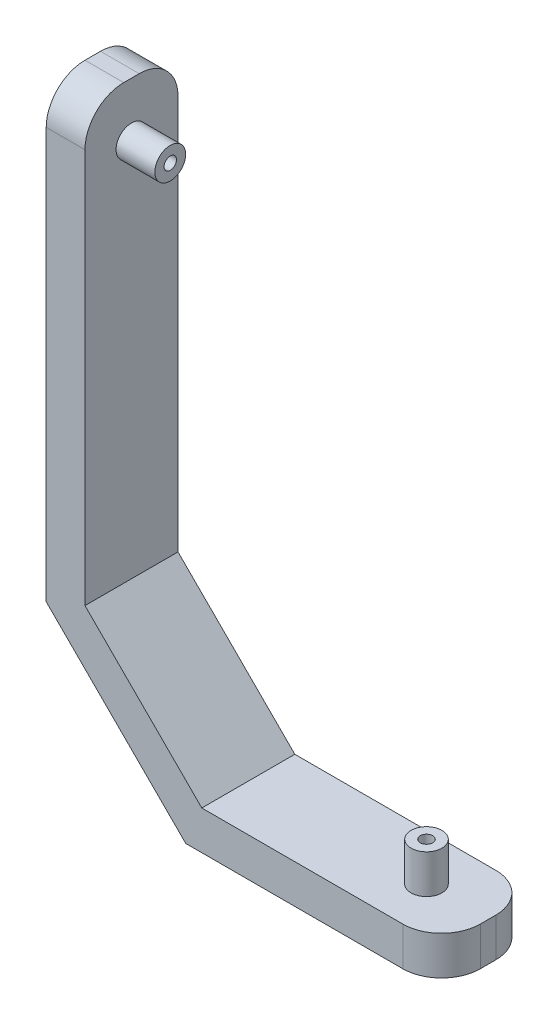
from build123d import *

# Parameters (mm, degrees)
BOSS_EXTRUDE7_DEPTH      = 12
BOSS_EXTRUDE7_DEPTH_BACK = 12
FILLET1_R                = 10
SKETCH1_R                = 3.98
BOSS_EXTRUDE3_DEPTH      = 10
SKETCH5_R                = 1.6
CUT_EXTRUDE1_DEPTH       = 165.414111317
SKETCH6_R                = 2
CUT_EXTRUDE2_DEPTH       = 3
SKETCH7_R                = 3.98
BOSS_EXTRUDE5_DEPTH      = 10
SKETCH9_R                = 1.6
CUT_EXTRUDE3_DEPTH       = 17
SKETCH10_R               = 4
CUT_EXTRUDE4_DEPTH       = 3


with BuildPart() as part:
    # Sketch11 → Boss-Extrude7 (new, two sides: drawn at the far end of the back side and taken through both)
    with BuildSketch(Plane.XY.offset(-BOSS_EXTRUDE7_DEPTH_BACK)):
        Polygon((-86.2, 142), (-86.2, 26), (-50.2, -10), (15.8, -10), (15.8, 0), (-46.057864376, 0), (-76.2, 30.142135624), (-76.2, 142), align=None)
    extrude(amount=BOSS_EXTRUDE7_DEPTH + BOSS_EXTRUDE7_DEPTH_BACK)

    # Fillet1
    fillet1_edges = [part.edges().sort_by_distance(p)[0] for p in [
        (-81.2, 142, -12),
        (15.8, -5, -12),
        (15.8, -5, 12),
        (-81.2, 142, 12),
    ]]
    fillet(fillet1_edges, radius=FILLET1_R)

    # Sketch1 → Boss-Extrude3 (add)
    with BuildSketch(Plane(origin=(-76.2, 0, 0), x_dir=(0, 0, -1), z_dir=(1, 0, 0))):
        with Locations((0, 128)):
            Circle(SKETCH1_R)
    extrude(amount=BOSS_EXTRUDE3_DEPTH)

    # Sketch5 → Cut-Extrude1 (cut, through all)
    with BuildSketch(Plane(origin=(-66.2, 0, 0), x_dir=(0, 0, -1), z_dir=(1, 0, 0))):
        with Locations((0, 128)):
            Circle(SKETCH5_R)
    extrude(amount=-CUT_EXTRUDE1_DEPTH, mode=Mode.SUBTRACT)

    # Sketch6 → Cut-Extrude2 (cut)
    with BuildSketch(Plane.ZY.offset(86.2)):
        with Locations((0, 128)):
            Circle(SKETCH6_R)
    extrude(amount=-CUT_EXTRUDE2_DEPTH, mode=Mode.SUBTRACT)

    # Sketch7 → Boss-Extrude5 (add)
    with BuildSketch(Plane(origin=(0, 0, 0), x_dir=(1, 0, 0), z_dir=(0, 1, 0))):
        with Locations((-0.08822806, 0)):
            Circle(SKETCH7_R)
    extrude(amount=BOSS_EXTRUDE5_DEPTH)

    # Sketch9 → Cut-Extrude3 (cut)
    with BuildSketch(Plane(origin=(0, 10, 0), x_dir=(1, 0, 0), z_dir=(0, 1, 0))):
        with Locations((-0.08822806, 0)):
            Circle(SKETCH9_R)
    extrude(amount=-CUT_EXTRUDE3_DEPTH, mode=Mode.SUBTRACT)

    # Sketch10 → Cut-Extrude4 (cut)
    with BuildSketch(Plane.XZ.offset(10)):
        with Locations((-0.08822806, 0)):
            Circle(SKETCH10_R)
    extrude(amount=-CUT_EXTRUDE4_DEPTH, mode=Mode.SUBTRACT)


solid = part.part
